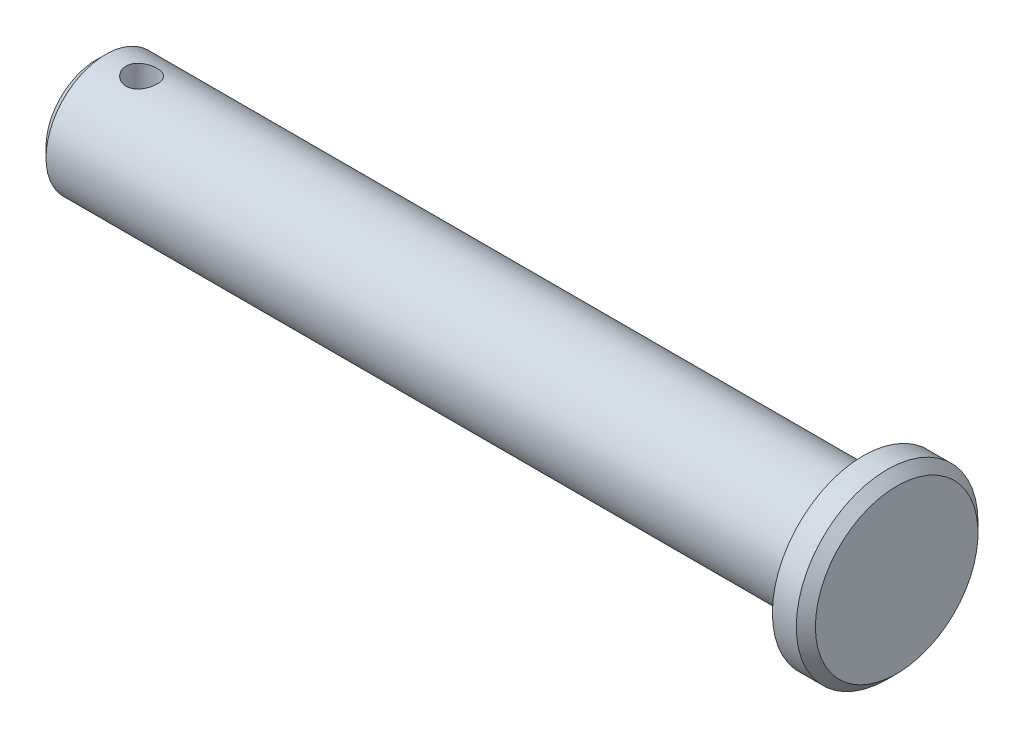
from build123d import *

# Parameters (mm, degrees)
CORTE_EXTRUS_O1_DEPTH      = 88.897759357
CORTE_EXTRUS_O1_DEPTH_BACK = 88.897759357
ESBO_O2_R                  = 3.25


with BuildPart() as part:
    # Esboço1 → Revolução1 (revolve)
    with BuildSketch(Plane.XY, mode=Mode.PRIVATE) as revolu_o1_sk:
        Polygon((83.69, 0), (83.69, 17), (81.69, 19), (76.69, 19), (76.69, 12.5), (-81.69, 12.5), (-83.69, 10.5), (-83.69, 0), align=None)
    revolve(revolu_o1_sk.sketch.rotate(Axis((-83.69, 0, 0), (1, 0, 0)), 90), axis=Axis((-83.69, 0, 0), (1, 0, 0)))

    # Esboço2 → Corte-extrusão1 (cut, two sides: drawn at the far end of the back side and taken through both)
    with BuildSketch(Plane(origin=(0, 0, 0), x_dir=(1, 0, 0), z_dir=(0, 1, 0)).offset(-CORTE_EXTRUS_O1_DEPTH_BACK)):
        with Locations(Location((-74.19, 0, 0), (0, 0, 270))):
            Circle(ESBO_O2_R)
    extrude(amount=CORTE_EXTRUS_O1_DEPTH + CORTE_EXTRUS_O1_DEPTH_BACK, mode=Mode.SUBTRACT)


solid = part.part
